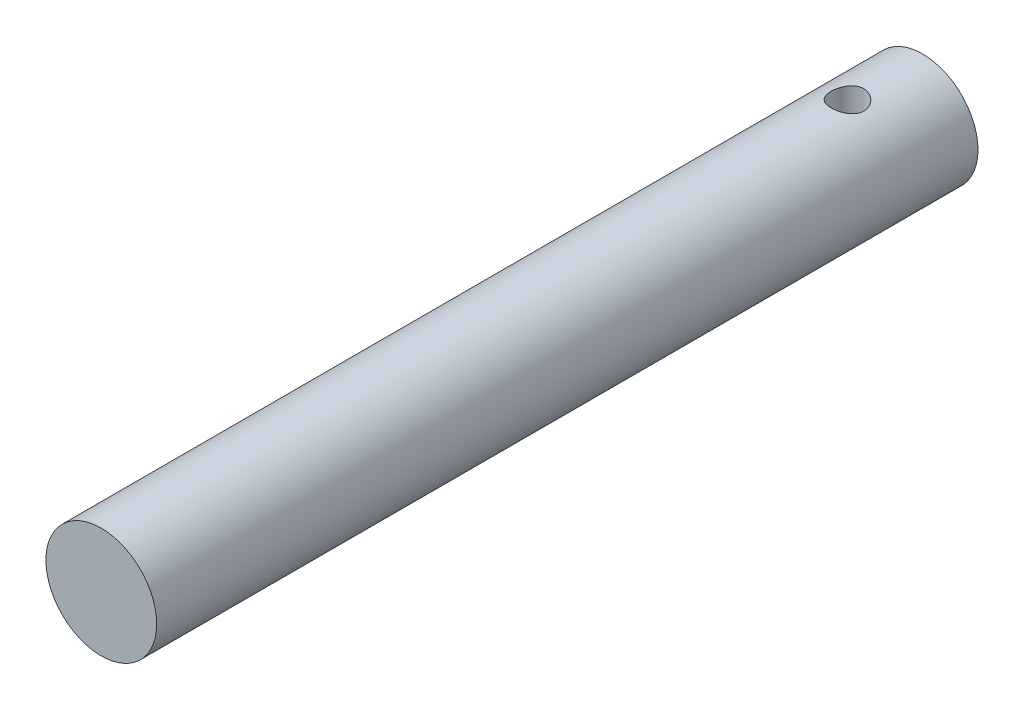
from build123d import *

# Parameters (mm, degrees)
SKETCH3_R           = 6
BOSS_EXTRUDE1_DEPTH = 89
SKETCH4_R           = 1.787461207
SKETCH4_R_2         = 2
CUT_EXTRUDE1_DEPTH  = 90.403579347
SKETCH4_2_R         = 1.787461207
SKETCH4_2_R_2       = 2
CUT_EXTRUDE2_DEPTH  = 90.403579462


with BuildPart() as part:
    # Sketch3 → Boss-Extrude1 (new body)
    with BuildSketch(Plane.XY):
        Circle(SKETCH3_R)
    extrude(amount=BOSS_EXTRUDE1_DEPTH)

    # Sketch4 → Cut-Extrude1 (cut, through all)
    with BuildSketch(Plane(origin=(0, 0, 0), x_dir=(1, 0, 0), z_dir=(0, 1, 0))):
        with Locations((0.096225649, -8.236803081)):
            Circle(SKETCH4_R)
        with Locations((0, -123.236762823)):
            Circle(SKETCH4_R_2)
    extrude(amount=-CUT_EXTRUDE1_DEPTH, mode=Mode.SUBTRACT)

    # Sketch4<2> → Cut-Extrude2 (cut, through all)
    with BuildSketch(Plane(origin=(0, 0, 0), x_dir=(1, 0, 0), z_dir=(0, 1, 0))):
        with Locations((0.096225649, -8.236803081)):
            Circle(SKETCH4_2_R)
        with Locations((0, -123.236762823)):
            Circle(SKETCH4_2_R_2)
    extrude(amount=CUT_EXTRUDE2_DEPTH, mode=Mode.SUBTRACT)


solid = part.part
